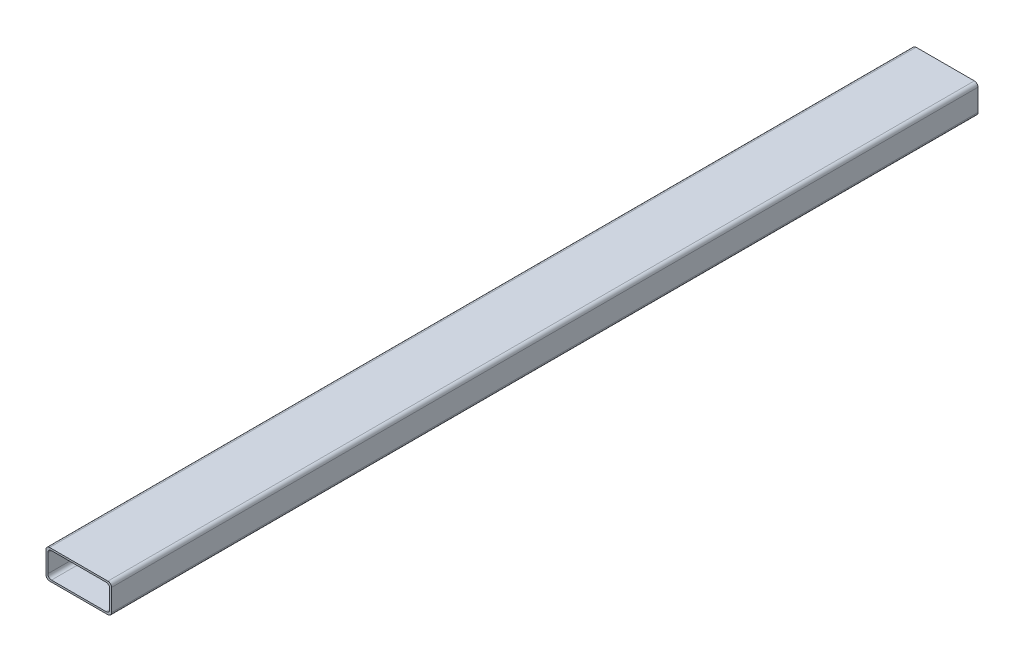
from build123d import *

# Parameters (mm, degrees)
SKETCH1_W           = 114.3
SKETCH1_H           = 50.8
SKETCH1_W_2         = 107.95
SKETCH1_H_2         = 44.45
BOSS_EXTRUDE1_DEPTH = 1511.3
FILLET1_R           = 6.35


with BuildPart() as part:
    # Sketch1 → Boss-Extrude1 (new body)
    with BuildSketch(Plane.XY):
        Rectangle(SKETCH1_W, SKETCH1_H)
        Rectangle(SKETCH1_W_2, SKETCH1_H_2, mode=Mode.SUBTRACT)
    extrude(amount=BOSS_EXTRUDE1_DEPTH)

    # Fillet1
    fillet1_edges = [part.edges().sort_by_distance(p)[0] for p in [
        (53.975, -22.225, 755.65),
        (53.975, 22.225, 755.65),
        (-53.975, 22.225, 755.65),
        (-53.975, -22.225, 755.65),
        (57.15, -25.4, 755.65),
        (-57.15, -25.4, 755.65),
        (-57.15, 25.4, 755.65),
        (57.15, 25.4, 755.65),
    ]]
    fillet(fillet1_edges, radius=FILLET1_R)


solid = part.part
